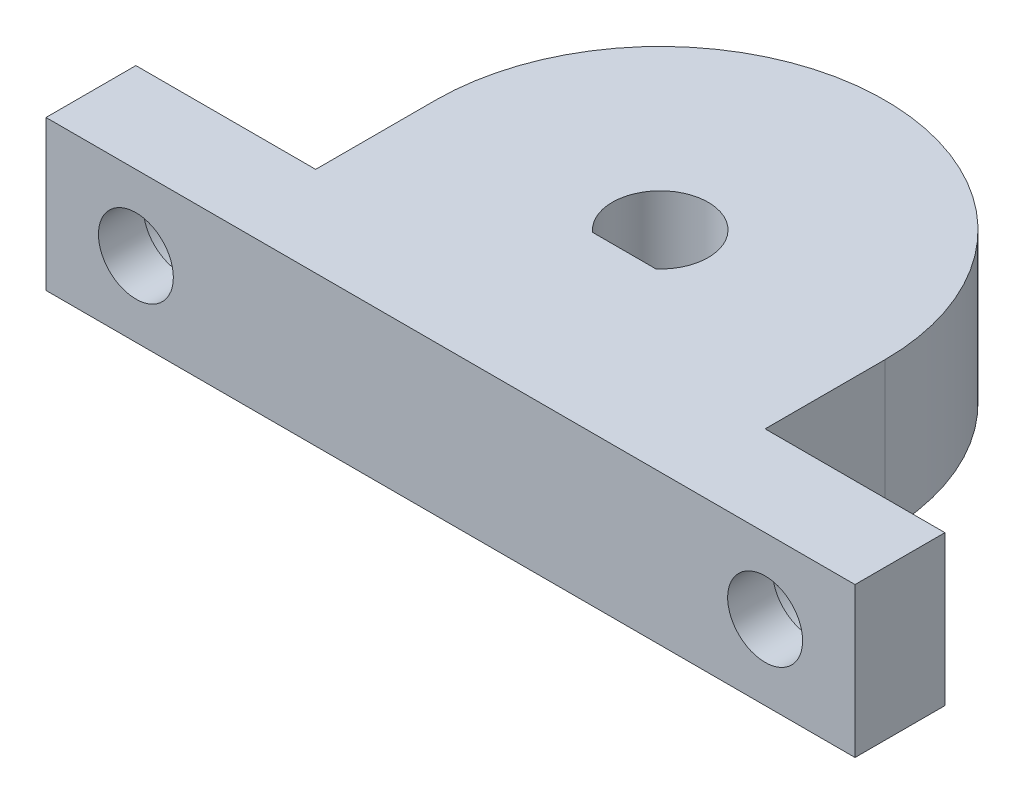
from build123d import *

# Parameters (mm, degrees)
SKETCH_2_W          = 170
SKETCH_2_H          = 20
EXTRUDE_1_DEPTH     = 23
CUT_EXTRUDE_1_DEPTH = 173.710740836
SKETCH_4_W          = 17
SKETCH_4_H          = 13
CUT_EXTRUDE_2_DEPTH = 30
CUT_EXTRUDE_3_DEPTH = 173.710740836
SKETCH_6_W          = 67.5
SKETCH_6_H          = 3
SKETCH_6_W_2        = 15
SKETCH_6_H_2        = 14.5
CUT_EXTRUDE_4_DEPTH = 173.710740836
SKETCH_7_W          = 25.348417758
SKETCH_7_H          = 9.515527538
CUT_EXTRUDE_5_DEPTH = 33.295510524
SKETCH_8_W          = 27
SKETCH_8_H          = 5
SKETCH_8_R          = 1.25
EXTRUDE_2_DEPTH     = 3
CUT_EXTRUDE_START   = -3
SKETCH_8_3_R        = 2
CUT_EXTRUDE_6_DEPTH = 1.5


with BuildPart() as part:
    # 草图2 → 凸台-拉伸1 (new body)
    with BuildSketch(Plane(origin=(0, 0, 0), x_dir=(1, 0, 0), z_dir=(0, 1, 0))):
        with Locations((85, -10)):
            Rectangle(SKETCH_2_W, SKETCH_2_H)
    extrude(amount=EXTRUDE_1_DEPTH)

    # 草图3 → 切除-拉伸1 (cut, through all)
    with BuildSketch(Plane(origin=(0, 23, 0), x_dir=(1, 0, 0), z_dir=(0, 1, 0))):
        with BuildLine():
            ThreePointArc((161.6, -10), (159.341699476, -8.541699476), (158.941699476, -11.2))
            Line((158.941699476, -11.2), (161.058300524, -11.2))
            ThreePointArc((161.058300524, -11.2), (161.458300524, -10.658300524), (161.6, -10))
        make_face()
        with BuildLine():
            ThreePointArc((126.6, -10), (124.341699476, -8.541699476), (123.941699476, -11.2))
            Line((123.941699476, -11.2), (126.058300524, -11.2))
            ThreePointArc((126.058300524, -11.2), (126.458300524, -10.658300524), (126.6, -10))
        make_face()
    extrude(amount=-CUT_EXTRUDE_1_DEPTH, mode=Mode.SUBTRACT)

    # 草图4 → 切除-拉伸2 (cut)
    with BuildSketch(Plane(origin=(170, 0, 0), x_dir=(0, 0, -1), z_dir=(1, 0, 0))):
        with Locations((-8.5, 11.5)):
            Rectangle(SKETCH_4_W, SKETCH_4_H)
    extrude(amount=-CUT_EXTRUDE_2_DEPTH, mode=Mode.SUBTRACT)

    # 草图5 → 切除-拉伸3 (cut, through all)
    with BuildSketch(Plane(origin=(0, 23, 0), x_dir=(1, 0, 0), z_dir=(0, 1, 0))):
        with BuildLine():
            Line((117.5, -17), (117.5, -10))
            ThreePointArc((117.5, -10), (125, -2.5), (132.5, -10))
            Line((132.5, -10), (132.5, -17))
            Line((132.5, -17), (152.5, -17))
            Line((152.5, -17), (152.5, -10))
            ThreePointArc((152.5, -10), (160, -2.5), (167.5, -10))
            Line((167.5, -10), (167.5, -17))
            Line((167.5, -17), (170, -17))
            Line((170, -17), (170, 0))
            Line((170, 0), (0, 0))
            Line((0, 0), (0, -20))
            Line((0, -20), (102.5, -20))
            Line((102.5, -20), (102.5, -17))
            Line((102.5, -17), (117.5, -17))
        make_face()
    extrude(amount=-CUT_EXTRUDE_3_DEPTH, mode=Mode.SUBTRACT)

    # 草图6 → 切除-拉伸4 (cut, through all)
    with BuildSketch(Plane(origin=(0, 23, 0), x_dir=(1, 0, 0), z_dir=(0, 1, 0))):
        with Locations((136.25, -18.5)):
            Rectangle(SKETCH_6_W, SKETCH_6_H)
        with Locations((125, -9.75)):
            Rectangle(SKETCH_6_W_2, SKETCH_6_H_2)
    extrude(amount=-CUT_EXTRUDE_4_DEPTH, mode=Mode.SUBTRACT)


with BuildPart() as cut_extrude_4_piece_1:
    # of the separate pieces the step leaves, piece 1, a body of its own (cut_extrude_4_pieces)
    add(part.part.solids().sort_by_distance((167.5, 23, 10))[0])

    # 草图7 → 切除-拉伸5 (cut, through all)
    with BuildSketch(Plane.ZY.offset(-152.5)):
        with Locations((10.223802201, 19.727293576)):
            Rectangle(SKETCH_7_W, SKETCH_7_H)
    extrude(amount=-CUT_EXTRUDE_5_DEPTH, mode=Mode.SUBTRACT)


with BuildPart() as cut_extrude_4_piece_2:
    # of the separate pieces the step leaves, piece 2, a body of its own (cut_extrude_4_pieces)
    add(part.part.solids().sort_by_distance((167.5, 0, 17))[0])

    # 草图8 → 凸台-拉伸2 (add)
    with BuildSketch(Plane.XY.offset(17)):
        with Locations((160, 2.5)):
            Rectangle(SKETCH_8_W, SKETCH_8_H)
        with Locations((149.5, 2.5)):
            Circle(SKETCH_8_R, mode=Mode.SUBTRACT)
        with Locations((170.5, 2.5)):
            Circle(SKETCH_8_R, mode=Mode.SUBTRACT)
    extrude(amount=-EXTRUDE_2_DEPTH)

    # 草图8<3> → 切除-拉伸6 (cut)
    with BuildSketch(Plane.XY.offset(17).offset(CUT_EXTRUDE_START)):
        with Locations((170.5, 2.5)):
            Circle(SKETCH_8_3_R)
        with Locations((149.5, 2.5)):
            Circle(SKETCH_8_3_R)
    extrude(amount=CUT_EXTRUDE_6_DEPTH, mode=Mode.SUBTRACT)


solid = cut_extrude_4_piece_2.part
